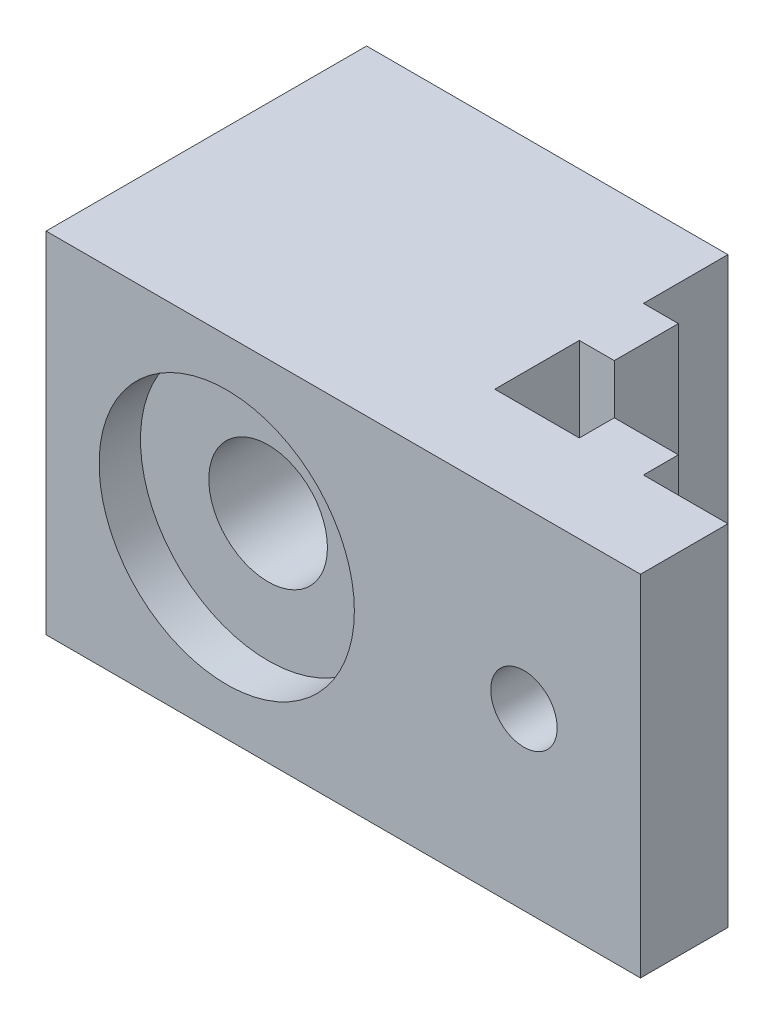
from build123d import *
from build123d.topology import SkipClean

# Parameters (mm, degrees)
SKETCH_1_W           = 51
SKETCH_1_H           = 30
EXTRUDE_5_DEPTH      = 7.5
SKETCH_4_W           = 31
SKETCH_4_H           = 30
EXTRUDE_6_DEPTH      = 20
SKETCH_6_W           = 5.5
SKETCH_6_H           = 10
EXTRUDE_9_DEPTH      = 3
SKETCH_10_W          = 5.5
SKETCH_10_H          = 10
EXTRUDE_10_DEPTH     = 3
SKETCH_13_R          = 10.95
CUT_EXTRUDE_1_DEPTH  = 3.55
CUT_EXTRUDE_2_DEPTH  = 10.3
CUT_EXTRUDE_3_DEPTH  = 33.666075675
CUT_EXTRUDE_5_DEPTH  = 41.391830857
CUT_EXTRUDE_7_DEPTH  = 57.797887285
EXTRUDE_12_DEPTH     = 31
CUT_EXTRUDE_13_DEPTH = 57.79788732
EXTRUDE_14_DEPTH     = 7.5
CUT_EXTRUDE_14_DEPTH = 41.391830988


with BuildPart() as part:
    # Эскиз1 → Бобышка-Вытянуть5 (new body)
    with BuildSketch(Plane.XY):
        Rectangle(SKETCH_1_W, SKETCH_1_H)
    extrude(amount=EXTRUDE_5_DEPTH)

    # Эскиз4 → Бобышка-Вытянуть6 (add)
    with BuildSketch(Plane(origin=(0, 0, 0), x_dir=(-1, 0, 0), z_dir=(0, 0, -1))):
        with Locations((10, 0)):
            Rectangle(SKETCH_4_W, SKETCH_4_H)
    extrude(amount=EXTRUDE_6_DEPTH)

    # Эскиз6 → Бобышка-Вытянуть9 (add)
    with BuildSketch(Plane(origin=(0, 0, 0), x_dir=(-1, 0, 0), z_dir=(0, 0, -1))):
        with Locations((-15.5, 10)):
            Rectangle(SKETCH_6_W, SKETCH_6_H)
        with Locations((-15.5, -10)):
            Rectangle(SKETCH_6_W, SKETCH_6_H)
    extrude(amount=EXTRUDE_9_DEPTH)

    # Эскиз10 → Бобышка-Вытянуть10 (add)
    with BuildSketch(Plane(origin=(5.5, 0, 0), x_dir=(0, 0, -1), z_dir=(1, 0, 0))):
        with Locations((10, 10)):
            Rectangle(SKETCH_10_W, SKETCH_10_H)
        with Locations((10, -10)):
            Rectangle(SKETCH_10_W, SKETCH_10_H)
    extrude(amount=EXTRUDE_10_DEPTH)

    # Эскиз13 → Вырез-Вытянуть1 (cut)
    with BuildSketch(Plane.XY.offset(7.5)):
        with Locations((-10, 0)):
            Circle(SKETCH_13_R)
    extrude(amount=-CUT_EXTRUDE_1_DEPTH, mode=Mode.SUBTRACT)

    # Эскиз14 → Вырез-Вытянуть2 (cut)
    with BuildSketch(Plane.XY.offset(3.95)):
        with BuildLine():
            ThreePointArc((-4.91, 0), (-6.400826484, 3.599173516), (-10, 5.09))
            Line((-10, 5.09), (-10, -5.09))
            ThreePointArc((-10, -5.09), (-6.400826484, -3.599173516), (-4.91, 0))
        make_face()
        with BuildLine():
            Line((-10, -5.09), (-10, 5.09))
            ThreePointArc((-10, 5.09), (-15.09, 0), (-10, -5.09))
        make_face()
    extrude(amount=-CUT_EXTRUDE_2_DEPTH, mode=Mode.SUBTRACT)

    # Эскиз15 → Вырез-Вытянуть3 (cut, through all)
    with BuildSketch(Plane.XY.offset(-6.35)):
        with BuildLine():
            ThreePointArc((-5.7, 0), (-6.959440841, 3.040559159), (-10, 4.3))
            Line((-10, 4.3), (-10, -4.3))
            ThreePointArc((-10, -4.3), (-6.959440841, -3.040559159), (-5.7, 0))
        make_face()
        with BuildLine():
            Line((-10, -4.3), (-10, 4.3))
            ThreePointArc((-10, 4.3), (-14.3, 0), (-10, -4.3))
        make_face()
    extrude(amount=-CUT_EXTRUDE_3_DEPTH, mode=Mode.SUBTRACT)

    # Эскиз16 → Вырез-Вытянуть5 (cut, through all)
    with BuildSketch(Plane.XY.offset(7.5)):
        with BuildLine():
            ThreePointArc((18.3, 0), (17.479898987, 1.979898987), (15.5, 2.8))
            Line((15.5, 2.8), (15.5, -2.8))
            ThreePointArc((15.5, -2.8), (17.479898987, -1.979898987), (18.3, 0))
        make_face()
        with BuildLine():
            Line((15.5, -2.8), (15.5, 2.8))
            ThreePointArc((15.5, 2.8), (12.7, 0), (15.5, -2.8))
        make_face()
    extrude(amount=-CUT_EXTRUDE_5_DEPTH, mode=Mode.SUBTRACT)

    # Эскиз17 → Вырез-Вытянуть7 (cut, through all)
    with SkipClean():  # the faces are left unmerged after this step: merging them gives an invalid solid
        with BuildSketch(Plane.ZY.offset(25.5)):
            with BuildLine():
                ThreePointArc((-12.6, 0), (-10, -2.6), (-7.4, 0))
                Line((-7.4, 0), (-12.6, 0))
            make_face()
            with BuildLine():
                Line((-12.6, 0), (-7.4, 0))
                ThreePointArc((-7.4, 0), (-10, 2.6), (-12.6, 0))
            make_face()
        extrude(amount=-CUT_EXTRUDE_7_DEPTH, mode=Mode.SUBTRACT)

    # Эскиз23 → Бобышка-Вытянуть12 (add)
    with SkipClean():  # the faces are left unmerged after this step: merging them gives an invalid solid
        with BuildSketch(Plane.ZY.offset(25.5)):
            with BuildLine():
                ThreePointArc((-12.6, 0), (-10, -2.6), (-7.4, 0))
                Line((-7.4, 0), (-12.6, 0))
            make_face()
            with BuildLine():
                Line((-12.6, 0), (-7.4, 0))
                ThreePointArc((-7.4, 0), (-10, 2.6), (-12.6, 0))
            make_face()
        extrude(amount=-EXTRUDE_12_DEPTH)

    # Эскиз24 → Вырез-Вытянуть13 (cut, through all)
    with BuildSketch(Plane.ZY.offset(25.5)):
        with BuildLine():
            ThreePointArc((-7.15, 0), (-10, 2.85), (-12.85, 0))
            Line((-12.85, 0), (-7.15, 0))
        make_face()
        with BuildLine():
            Line((-7.15, 0), (-12.85, 0))
            ThreePointArc((-12.85, 0), (-10, -2.85), (-7.15, 0))
        make_face()
    extrude(amount=-CUT_EXTRUDE_13_DEPTH, mode=Mode.SUBTRACT)

    # Эскиз27 → Бобышка-Вытянуть14 (add)
    with BuildSketch(Plane.XY.offset(7.5)):
        with BuildLine():
            ThreePointArc((15.5, 2.8), (12.7, 0), (15.5, -2.8))
            Line((15.5, -2.8), (15.5, 2.8))
        make_face()
        with BuildLine():
            Line((15.5, 2.8), (15.5, -2.8))
            ThreePointArc((15.5, -2.8), (17.479898987, -1.979898987), (18.3, 0))
            ThreePointArc((18.3, 0), (17.479898987, 1.979898987), (15.5, 2.8))
        make_face()
    extrude(amount=-EXTRUDE_14_DEPTH)

    # Эскиз28 → Вырез-Вытянуть14 (cut, through all)
    with BuildSketch(Plane.XY.offset(7.5)):
        with BuildLine():
            ThreePointArc((15.5, 2.85), (12.65, 0), (15.5, -2.85))
            Line((15.5, -2.85), (15.5, 2.85))
        make_face()
        with BuildLine():
            Line((15.5, 2.85), (15.5, -2.85))
            ThreePointArc((15.5, -2.85), (17.515254326, -2.015254326), (18.35, 0))
            ThreePointArc((18.35, 0), (17.515254326, 2.015254326), (15.5, 2.85))
        make_face()
    extrude(amount=-CUT_EXTRUDE_14_DEPTH, mode=Mode.SUBTRACT)


solid = part.part
